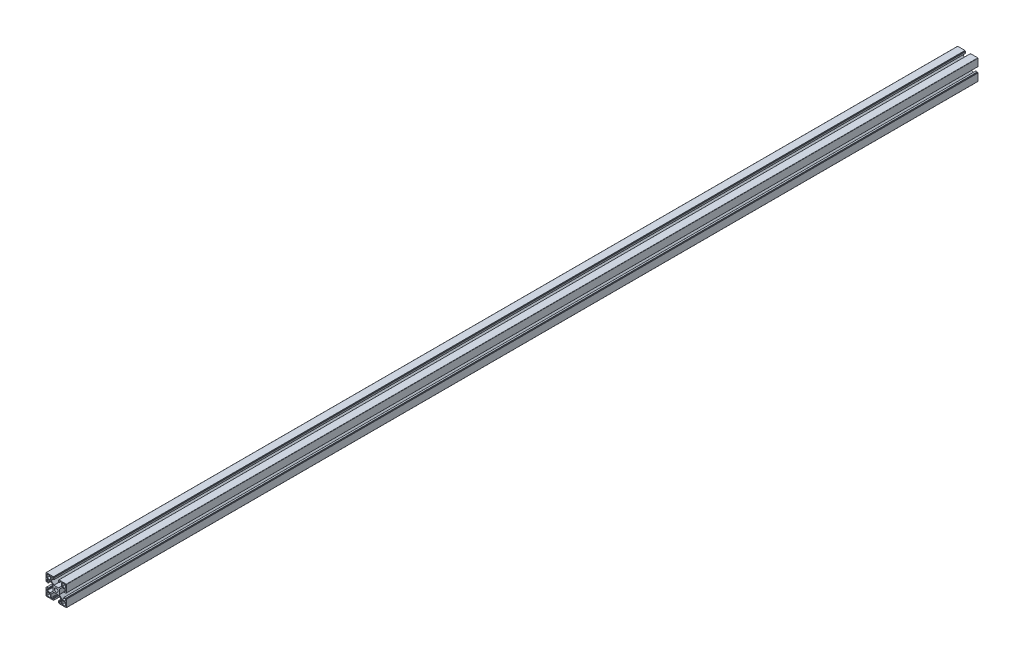
from build123d import *

# Parameters (mm, degrees)
SKETCH_1_R      = 3.4
EXTRUDE_1_DEPTH = 1780


with BuildPart() as part:
    # 草图1 → 凸台-拉伸1 (new body)
    with BuildSketch(Plane.XY):
        with BuildLine():
            Line((3539.027976017, 271.022298368), (3544.14929636, 265.900978025))
            ThreePointArc((3544.14929636, 265.900978025), (3544.257682736, 265.73876635), (3544.29574297, 265.547424634))
            Line((3544.29574297, 265.547424634), (3544.29574297, 259.468744978))
            ThreePointArc((3544.29574297, 259.468744978), (3544.14929636, 259.115191587), (3543.79574297, 258.968744978))
            Line((3543.79574297, 258.968744978), (3540.99574297, 258.968744978))
            ThreePointArc((3540.99574297, 258.968744978), (3540.642189579, 259.115191587), (3540.49574297, 259.468744978))
            Line((3540.49574297, 259.468744978), (3540.49574297, 261.368744978))
            ThreePointArc((3540.49574297, 261.368744978), (3540.407875004, 261.580877012), (3540.19574297, 261.668744978))
            Line((3540.19574297, 261.668744978), (3538.69574297, 261.668744978))
            ThreePointArc((3538.69574297, 261.668744978), (3538.483610935, 261.580877012), (3538.39574297, 261.368744978))
            Line((3538.39574297, 261.368744978), (3538.39574297, 258.468744978))
            ThreePointArc((3538.39574297, 258.468744978), (3538.483610935, 258.256612943), (3538.69574297, 258.168744978))
            Line((3538.69574297, 258.168744978), (3539.19574297, 258.168744978))
            ThreePointArc((3539.19574297, 258.168744978), (3539.337164326, 258.110166334), (3539.39574297, 257.968744978))
            Line((3539.39574297, 257.968744978), (3539.39574297, 257.468744978))
            ThreePointArc((3539.39574297, 257.468744978), (3539.483610935, 257.256612943), (3539.69574297, 257.168744978))
            Line((3539.69574297, 257.168744978), (3553.79574297, 257.168744978))
            ThreePointArc((3553.79574297, 257.168744978), (3554.14929636, 257.315191587), (3554.29574297, 257.668744978))
            Line((3554.29574297, 257.668744978), (3554.29574297, 271.768744978))
            ThreePointArc((3554.29574297, 271.768744978), (3554.207875004, 271.980877012), (3553.99574297, 272.068744978))
            Line((3553.99574297, 272.068744978), (3553.49574297, 272.068744978))
            ThreePointArc((3553.49574297, 272.068744978), (3553.354321613, 272.127323621), (3553.29574297, 272.268744978))
            Line((3553.29574297, 272.268744978), (3553.29574297, 272.768744978))
            ThreePointArc((3553.29574297, 272.768744978), (3553.207875004, 272.980877012), (3552.99574297, 273.068744978))
            Line((3552.99574297, 273.068744978), (3550.09574297, 273.068744978))
            ThreePointArc((3550.09574297, 273.068744978), (3549.883610935, 272.980877012), (3549.79574297, 272.768744978))
            Line((3549.79574297, 272.768744978), (3549.79574297, 271.268744978))
            ThreePointArc((3549.79574297, 271.268744978), (3549.883610935, 271.056612943), (3550.09574297, 270.968744978))
            Line((3550.09574297, 270.968744978), (3551.99574297, 270.968744978))
            ThreePointArc((3551.99574297, 270.968744978), (3552.34929636, 270.822298368), (3552.49574297, 270.468744978))
            Line((3552.49574297, 270.468744978), (3552.49574297, 267.668744978))
            ThreePointArc((3552.49574297, 267.668744978), (3552.34929636, 267.315191587), (3551.99574297, 267.168744978))
            Line((3551.99574297, 267.168744978), (3545.917063313, 267.168744978))
            ThreePointArc((3545.917063313, 267.168744978), (3545.725721597, 267.206805211), (3545.563509923, 267.315191587))
            Line((3545.563509923, 267.315191587), (3540.442189579, 272.436511931))
            ThreePointArc((3540.442189579, 272.436511931), (3540.333803203, 272.598723605), (3540.29574297, 272.790065321))
            Line((3540.29574297, 272.790065321), (3540.29574297, 281.547424634))
            ThreePointArc((3540.29574297, 281.547424634), (3540.333803203, 281.73876635), (3540.442189579, 281.900978025))
            Line((3540.442189579, 281.900978025), (3545.563509923, 287.022298368))
            ThreePointArc((3545.563509923, 287.022298368), (3545.725721597, 287.130684744), (3545.917063313, 287.168744978))
            Line((3545.917063313, 287.168744978), (3551.99574297, 287.168744978))
            ThreePointArc((3551.99574297, 287.168744978), (3552.34929636, 287.022298368), (3552.49574297, 286.668744978))
            Line((3552.49574297, 286.668744978), (3552.49574297, 283.868744978))
            ThreePointArc((3552.49574297, 283.868744978), (3552.34929636, 283.515191587), (3551.99574297, 283.368744978))
            Line((3551.99574297, 283.368744978), (3550.09574297, 283.368744978))
            ThreePointArc((3550.09574297, 283.368744978), (3549.883610935, 283.280877012), (3549.79574297, 283.068744978))
            Line((3549.79574297, 283.068744978), (3549.79574297, 281.568744978))
            ThreePointArc((3549.79574297, 281.568744978), (3549.883610935, 281.356612943), (3550.09574297, 281.268744978))
            Line((3550.09574297, 281.268744978), (3552.99574297, 281.268744978))
            ThreePointArc((3552.99574297, 281.268744978), (3553.207875004, 281.356612943), (3553.29574297, 281.568744978))
            Line((3553.29574297, 281.568744978), (3553.29574297, 282.068744978))
            ThreePointArc((3553.29574297, 282.068744978), (3553.354321613, 282.210166334), (3553.49574297, 282.268744978))
            Line((3553.49574297, 282.268744978), (3553.99574297, 282.268744978))
            ThreePointArc((3553.99574297, 282.268744978), (3554.207875004, 282.356612943), (3554.29574297, 282.568744978))
            Line((3554.29574297, 282.568744978), (3554.29574297, 296.668744978))
            ThreePointArc((3554.29574297, 296.668744978), (3554.14929636, 297.022298368), (3553.79574297, 297.168744978))
            Line((3553.79574297, 297.168744978), (3539.69574297, 297.168744978))
            ThreePointArc((3539.69574297, 297.168744978), (3539.483610935, 297.080877012), (3539.39574297, 296.868744978))
            Line((3539.39574297, 296.868744978), (3539.39574297, 296.368744978))
            ThreePointArc((3539.39574297, 296.368744978), (3539.337164326, 296.227323621), (3539.19574297, 296.168744978))
            Line((3539.19574297, 296.168744978), (3538.69574297, 296.168744978))
            ThreePointArc((3538.69574297, 296.168744978), (3538.483610935, 296.080877012), (3538.39574297, 295.868744978))
            Line((3538.39574297, 295.868744978), (3538.39574297, 292.968744978))
            ThreePointArc((3538.39574297, 292.968744978), (3538.483610935, 292.756612943), (3538.69574297, 292.668744978))
            Line((3538.69574297, 292.668744978), (3540.19574297, 292.668744978))
            ThreePointArc((3540.19574297, 292.668744978), (3540.407875004, 292.756612943), (3540.49574297, 292.968744978))
            Line((3540.49574297, 292.968744978), (3540.49574297, 294.868744978))
            ThreePointArc((3540.49574297, 294.868744978), (3540.642189579, 295.222298368), (3540.99574297, 295.368744978))
            Line((3540.99574297, 295.368744978), (3543.79574297, 295.368744978))
            ThreePointArc((3543.79574297, 295.368744978), (3544.14929636, 295.222298368), (3544.29574297, 294.868744978))
            Line((3544.29574297, 294.868744978), (3544.29574297, 288.790065321))
            ThreePointArc((3544.29574297, 288.790065321), (3544.257682736, 288.598723605), (3544.14929636, 288.436511931))
            Line((3544.14929636, 288.436511931), (3539.027976017, 283.315191587))
            ThreePointArc((3539.027976017, 283.315191587), (3538.865764342, 283.206805211), (3538.674422626, 283.168744978))
            Line((3538.674422626, 283.168744978), (3529.917063313, 283.168744978))
            ThreePointArc((3529.917063313, 283.168744978), (3529.725721597, 283.206805211), (3529.563509923, 283.315191587))
            Line((3529.563509923, 283.315191587), (3524.442189579, 288.436511931))
            ThreePointArc((3524.442189579, 288.436511931), (3524.333803203, 288.598723605), (3524.29574297, 288.790065321))
            Line((3524.29574297, 288.790065321), (3524.29574297, 294.868744978))
            ThreePointArc((3524.29574297, 294.868744978), (3524.442189579, 295.222298368), (3524.79574297, 295.368744978))
            Line((3524.79574297, 295.368744978), (3527.59574297, 295.368744978))
            ThreePointArc((3527.59574297, 295.368744978), (3527.94929636, 295.222298368), (3528.09574297, 294.868744978))
            Line((3528.09574297, 294.868744978), (3528.09574297, 292.968744978))
            ThreePointArc((3528.09574297, 292.968744978), (3528.183610935, 292.756612943), (3528.39574297, 292.668744978))
            Line((3528.39574297, 292.668744978), (3529.89574297, 292.668744978))
            ThreePointArc((3529.89574297, 292.668744978), (3530.107875004, 292.756612943), (3530.19574297, 292.968744978))
            Line((3530.19574297, 292.968744978), (3530.19574297, 295.868744978))
            ThreePointArc((3530.19574297, 295.868744978), (3530.107875004, 296.080877012), (3529.89574297, 296.168744978))
            Line((3529.89574297, 296.168744978), (3529.39574297, 296.168744978))
            ThreePointArc((3529.39574297, 296.168744978), (3529.254321613, 296.227323621), (3529.19574297, 296.368744978))
            Line((3529.19574297, 296.368744978), (3529.19574297, 296.868744978))
            ThreePointArc((3529.19574297, 296.868744978), (3529.107875004, 297.080877012), (3528.89574297, 297.168744978))
            Line((3528.89574297, 297.168744978), (3514.79574297, 297.168744978))
            ThreePointArc((3514.79574297, 297.168744978), (3514.442189579, 297.022298368), (3514.29574297, 296.668744978))
            Line((3514.29574297, 296.668744978), (3514.29574297, 282.568744978))
            ThreePointArc((3514.29574297, 282.568744978), (3514.383610935, 282.356612943), (3514.59574297, 282.268744978))
            Line((3514.59574297, 282.268744978), (3515.09574297, 282.268744978))
            ThreePointArc((3515.09574297, 282.268744978), (3515.237164326, 282.210166334), (3515.29574297, 282.068744978))
            Line((3515.29574297, 282.068744978), (3515.29574297, 281.568744978))
            ThreePointArc((3515.29574297, 281.568744978), (3515.383610935, 281.356612943), (3515.59574297, 281.268744978))
            Line((3515.59574297, 281.268744978), (3518.49574297, 281.268744978))
            ThreePointArc((3518.49574297, 281.268744978), (3518.707875004, 281.356612943), (3518.79574297, 281.568744978))
            Line((3518.79574297, 281.568744978), (3518.79574297, 283.068744978))
            ThreePointArc((3518.79574297, 283.068744978), (3518.707875004, 283.280877012), (3518.49574297, 283.368744978))
            Line((3518.49574297, 283.368744978), (3516.59574297, 283.368744978))
            ThreePointArc((3516.59574297, 283.368744978), (3516.242189579, 283.515191587), (3516.09574297, 283.868744978))
            Line((3516.09574297, 283.868744978), (3516.09574297, 286.668744978))
            ThreePointArc((3516.09574297, 286.668744978), (3516.242189579, 287.022298368), (3516.59574297, 287.168744978))
            Line((3516.59574297, 287.168744978), (3522.674422626, 287.168744978))
            ThreePointArc((3522.674422626, 287.168744978), (3522.865764342, 287.130684744), (3523.027976017, 287.022298368))
            Line((3523.027976017, 287.022298368), (3528.14929636, 281.900978025))
            ThreePointArc((3528.14929636, 281.900978025), (3528.257682736, 281.73876635), (3528.29574297, 281.547424634))
            Line((3528.29574297, 281.547424634), (3528.29574297, 272.790065321))
            ThreePointArc((3528.29574297, 272.790065321), (3528.257682736, 272.598723605), (3528.14929636, 272.436511931))
            Line((3528.14929636, 272.436511931), (3523.027976017, 267.315191587))
            ThreePointArc((3523.027976017, 267.315191587), (3522.865764342, 267.206805211), (3522.674422626, 267.168744978))
            Line((3522.674422626, 267.168744978), (3516.59574297, 267.168744978))
            ThreePointArc((3516.59574297, 267.168744978), (3516.242189579, 267.315191587), (3516.09574297, 267.668744978))
            Line((3516.09574297, 267.668744978), (3516.09574297, 270.468744978))
            ThreePointArc((3516.09574297, 270.468744978), (3516.242189579, 270.822298368), (3516.59574297, 270.968744978))
            Line((3516.59574297, 270.968744978), (3518.49574297, 270.968744978))
            ThreePointArc((3518.49574297, 270.968744978), (3518.707875004, 271.056612943), (3518.79574297, 271.268744978))
            Line((3518.79574297, 271.268744978), (3518.79574297, 272.768744978))
            ThreePointArc((3518.79574297, 272.768744978), (3518.707875004, 272.980877012), (3518.49574297, 273.068744978))
            Line((3518.49574297, 273.068744978), (3515.59574297, 273.068744978))
            ThreePointArc((3515.59574297, 273.068744978), (3515.383610935, 272.980877012), (3515.29574297, 272.768744978))
            Line((3515.29574297, 272.768744978), (3515.29574297, 272.268744978))
            ThreePointArc((3515.29574297, 272.268744978), (3515.237164326, 272.127323621), (3515.09574297, 272.068744978))
            Line((3515.09574297, 272.068744978), (3514.59574297, 272.068744978))
            ThreePointArc((3514.59574297, 272.068744978), (3514.383610935, 271.980877012), (3514.29574297, 271.768744978))
            Line((3514.29574297, 271.768744978), (3514.29574297, 257.668744978))
            ThreePointArc((3514.29574297, 257.668744978), (3514.442189579, 257.315191587), (3514.79574297, 257.168744978))
            Line((3514.79574297, 257.168744978), (3528.89574297, 257.168744978))
            ThreePointArc((3528.89574297, 257.168744978), (3529.107875004, 257.256612943), (3529.19574297, 257.468744978))
            Line((3529.19574297, 257.468744978), (3529.19574297, 257.968744978))
            ThreePointArc((3529.19574297, 257.968744978), (3529.254321613, 258.110166334), (3529.39574297, 258.168744978))
            Line((3529.39574297, 258.168744978), (3529.89574297, 258.168744978))
            ThreePointArc((3529.89574297, 258.168744978), (3530.107875004, 258.256612943), (3530.19574297, 258.468744978))
            Line((3530.19574297, 258.468744978), (3530.19574297, 261.368744978))
            ThreePointArc((3530.19574297, 261.368744978), (3530.107875004, 261.580877012), (3529.89574297, 261.668744978))
            Line((3529.89574297, 261.668744978), (3528.39574297, 261.668744978))
            ThreePointArc((3528.39574297, 261.668744978), (3528.183610935, 261.580877012), (3528.09574297, 261.368744978))
            Line((3528.09574297, 261.368744978), (3528.09574297, 259.468744978))
            ThreePointArc((3528.09574297, 259.468744978), (3527.94929636, 259.115191587), (3527.59574297, 258.968744978))
            Line((3527.59574297, 258.968744978), (3524.79574297, 258.968744978))
            ThreePointArc((3524.79574297, 258.968744978), (3524.442189579, 259.115191587), (3524.29574297, 259.468744978))
            Line((3524.29574297, 259.468744978), (3524.29574297, 265.547424634))
            ThreePointArc((3524.29574297, 265.547424634), (3524.333803203, 265.73876635), (3524.442189579, 265.900978025))
            Line((3524.442189579, 265.900978025), (3529.563509923, 271.022298368))
            ThreePointArc((3529.563509923, 271.022298368), (3529.725721597, 271.130684744), (3529.917063313, 271.168744978))
            Line((3529.917063313, 271.168744978), (3538.674422626, 271.168744978))
            ThreePointArc((3538.674422626, 271.168744978), (3538.865764342, 271.130684744), (3539.027976017, 271.022298368))
        make_face()
        with Locations(Location((3534.29574297, 277.168744978, 0), (0, 0, 180))):
            Circle(SKETCH_1_R, mode=Mode.SUBTRACT)
        with BuildLine():
            Line((3522.79574297, 265.168744978), (3522.79574297, 259.168744978))
            ThreePointArc((3522.79574297, 259.168744978), (3522.64929636, 258.815191587), (3522.29574297, 258.668744978))
            Line((3522.29574297, 258.668744978), (3516.29574297, 258.668744978))
            ThreePointArc((3516.29574297, 258.668744978), (3515.942189579, 258.815191587), (3515.79574297, 259.168744978))
            Line((3515.79574297, 259.168744978), (3515.79574297, 265.168744978))
            ThreePointArc((3515.79574297, 265.168744978), (3515.942189579, 265.522298368), (3516.29574297, 265.668744978))
            Line((3516.29574297, 265.668744978), (3522.29574297, 265.668744978))
            ThreePointArc((3522.29574297, 265.668744978), (3522.64929636, 265.522298368), (3522.79574297, 265.168744978))
        make_face(mode=Mode.SUBTRACT)
        with BuildLine():
            Line((3522.29574297, 288.668744978), (3516.29574297, 288.668744978))
            ThreePointArc((3516.29574297, 288.668744978), (3515.942189579, 288.815191587), (3515.79574297, 289.168744978))
            Line((3515.79574297, 289.168744978), (3515.79574297, 295.168744978))
            ThreePointArc((3515.79574297, 295.168744978), (3515.942189579, 295.522298368), (3516.29574297, 295.668744978))
            Line((3516.29574297, 295.668744978), (3522.29574297, 295.668744978))
            ThreePointArc((3522.29574297, 295.668744978), (3522.64929636, 295.522298368), (3522.79574297, 295.168744978))
            Line((3522.79574297, 295.168744978), (3522.79574297, 289.168744978))
            ThreePointArc((3522.79574297, 289.168744978), (3522.64929636, 288.815191587), (3522.29574297, 288.668744978))
        make_face(mode=Mode.SUBTRACT)
        with BuildLine():
            Line((3545.79574297, 289.168744978), (3545.79574297, 295.168744978))
            ThreePointArc((3545.79574297, 295.168744978), (3545.942189579, 295.522298368), (3546.29574297, 295.668744978))
            Line((3546.29574297, 295.668744978), (3552.29574297, 295.668744978))
            ThreePointArc((3552.29574297, 295.668744978), (3552.64929636, 295.522298368), (3552.79574297, 295.168744978))
            Line((3552.79574297, 295.168744978), (3552.79574297, 289.168744978))
            ThreePointArc((3552.79574297, 289.168744978), (3552.64929636, 288.815191587), (3552.29574297, 288.668744978))
            Line((3552.29574297, 288.668744978), (3546.29574297, 288.668744978))
            ThreePointArc((3546.29574297, 288.668744978), (3545.942189579, 288.815191587), (3545.79574297, 289.168744978))
        make_face(mode=Mode.SUBTRACT)
        with BuildLine():
            Line((3546.29574297, 265.668744978), (3552.29574297, 265.668744978))
            ThreePointArc((3552.29574297, 265.668744978), (3552.64929636, 265.522298368), (3552.79574297, 265.168744978))
            Line((3552.79574297, 265.168744978), (3552.79574297, 259.168744978))
            ThreePointArc((3552.79574297, 259.168744978), (3552.64929636, 258.815191587), (3552.29574297, 258.668744978))
            Line((3552.29574297, 258.668744978), (3546.29574297, 258.668744978))
            ThreePointArc((3546.29574297, 258.668744978), (3545.942189579, 258.815191587), (3545.79574297, 259.168744978))
            Line((3545.79574297, 259.168744978), (3545.79574297, 265.168744978))
            ThreePointArc((3545.79574297, 265.168744978), (3545.942189579, 265.522298368), (3546.29574297, 265.668744978))
        make_face(mode=Mode.SUBTRACT)
    extrude(amount=EXTRUDE_1_DEPTH)


solid = part.part
